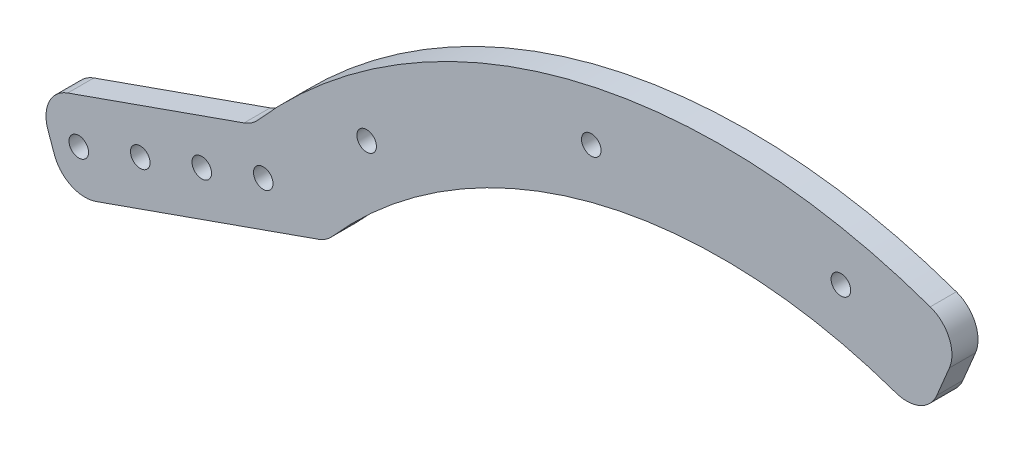
from build123d import *

# Parameters (mm, degrees)
BOSS_EXTRUDE1_DEPTH = 8
SKETCH2_R           = 3
CUT_EXTRUDE1_DEPTH  = 7.8
FILLET1_R           = 10


with BuildPart() as part:
    # Sketch1 → Boss-Extrude1 (new body)
    with BuildSketch(Plane.XY):
        with BuildLine():
            Line((-132.022045573, 65.789710007), (-212.176223927, 37.5))
            Line((-212.176223927, 37.5), (-220.823144233, 61.999607532))
            Line((-220.823144233, 61.999607532), (-154.813820882, 85.297015774))
            ThreePointArc((-154.813820882, 85.297015774), (-54.334940348, 146.616935984), (62.982038035, 136.980306335))
            Line((62.982038035, 136.980306335), (51.384993515, 109.312481006))
            ThreePointArc((51.384993515, 109.312481006), (-47.408251439, 117.427537553), (-132.022045573, 65.789710007))
        make_face()
    extrude(amount=BOSS_EXTRUDE1_DEPTH)

    # Sketch2 → Cut-Extrude1 (cut)
    with BuildSketch(Plane.XY.offset(8)):
        with Locations((-208.012771078, 52.745184826)):
            Circle(SKETCH2_R)
        with Locations((-189.152964406, 59.40158718)):
            Circle(SKETCH2_R)
        with Locations((-170.293157734, 66.057989535)):
            Circle(SKETCH2_R)
        with Locations((-151.433351063, 72.71439189)):
            Circle(SKETCH2_R)
        with Locations((25.722042378, 132.968245202)):
            Circle(SKETCH2_R)
        with Locations((-50.828871081, 131.842192364)):
            Circle(SKETCH2_R)
        with Locations((-119.723860621, 98.45370988)):
            Circle(SKETCH2_R)
    extrude(amount=-CUT_EXTRUDE1_DEPTH, mode=Mode.SUBTRACT)

    # Fillet1
    fillet1_edges = [part.edges().sort_by_distance(p)[0] for p in [
        (-220.823144233, 61.999607532, 4),
        (-154.813820882, 85.297015774, 4),
        (62.982038035, 136.980306335, 4),
        (51.384993515, 109.312481006, 4),
        (-132.022045573, 65.789710007, 4),
        (-212.176223927, 37.5, 4),
    ]]
    fillet(fillet1_edges, radius=FILLET1_R)


solid = part.part
